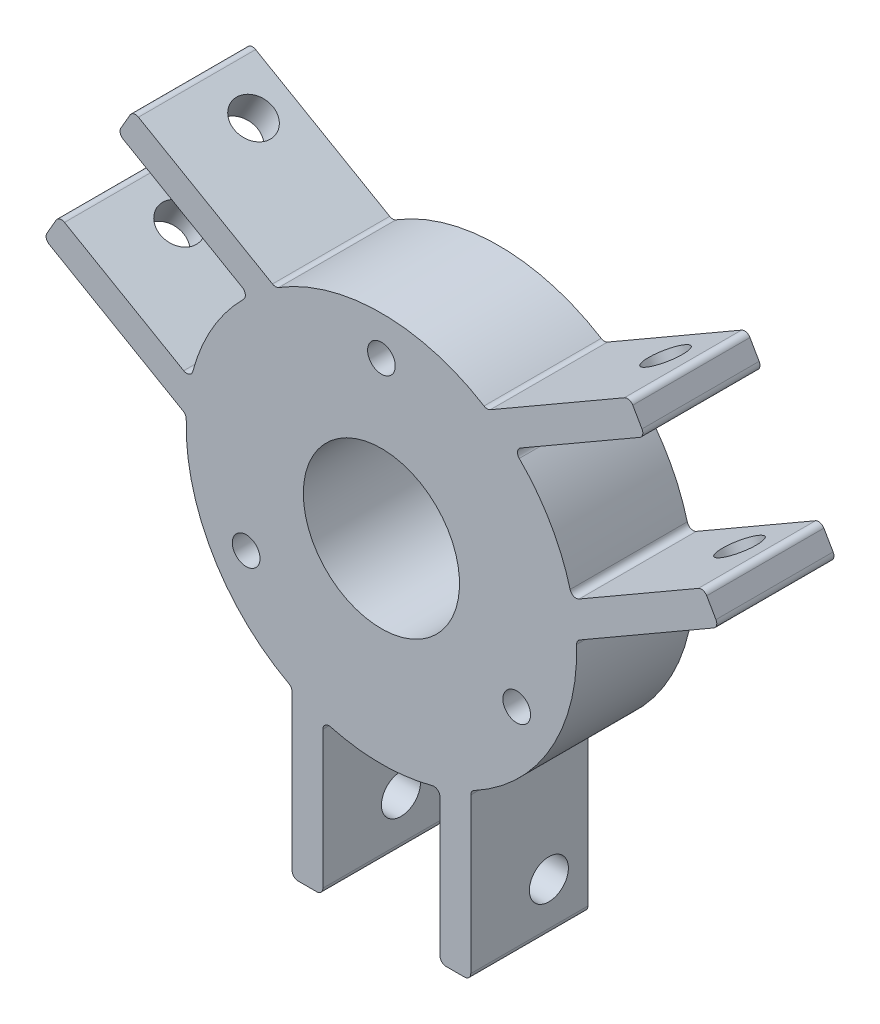
from build123d import *

# Parameters (mm, degrees)
ESQUISSE1_R             = 31.75
ESQUISSE1_R_2           = 12.7
ESQUISSE1_R_3           = 2.25
BOSS_EXTRU_1_DEPTH      = 19.05
BOSS_EXTRU_2_DEPTH      = 19.05
ESQUISSE3_R             = 3.175
ENL_V_MAT_EXTRU_1_DEPTH = 94.772298796
ESQUISSE4_R             = 3.175
ENL_V_MAT_EXTRU_2_DEPTH = 94.772298796
ESQUISSE5_R             = 3.175
ENL_V_MAT_EXTRU_3_DEPTH = 91.591863816
CONG_1_R                = 1


with BuildPart() as part:
    # Esquisse1 → Boss.-Extru.1 (new body)
    with BuildSketch(Plane.XY):
        with Locations(Location((0, 0, 0), (0, 0, 180))):
            Circle(ESQUISSE1_R)
        with Locations(Location((0, 0, 0), (0, 0, 180))):
            Circle(ESQUISSE1_R_2, mode=Mode.SUBTRACT)
        with Locations(Location((0, 25.4, 0), (0, 0, 180))):
            Circle(ESQUISSE1_R_3, mode=Mode.SUBTRACT)
        with Locations(Location((-21.997045256, -12.7, 0), (0, 0, 180))):
            Circle(ESQUISSE1_R_3, mode=Mode.SUBTRACT)
        with Locations(Location((21.997045256, -12.7, 0), (0, 0, 180))):
            Circle(ESQUISSE1_R_3, mode=Mode.SUBTRACT)
    extrude(amount=BOSS_EXTRU_1_DEPTH)

    # Esquisse2 → Boss.-Extru.2 (add)
    with BuildSketch(Plane.XY.offset(19.05)):
        Polygon((42.868897208, 35.748891971), (21.467304731, 23.392676794), (17.187758818, 26.6953825), (40.368897208, 40.07901899), align=None)
        Polygon((30.992304731, 6.894892851), (31.712758818, 1.53734452), (54.893897208, 14.92098101), (52.393897208, 19.251108029), align=None)
        Polygon((14.525, -55), (14.525, -28.23272702), (9.525, -30.287569645), (9.525, -55), align=None)
        Polygon((-9.525, -30.287569645), (-14.525, -28.23272702), (-14.525, -55), (-9.525, -55), align=None)
        Polygon((-54.893897208, 14.92098101), (-31.712758818, 1.53734452), (-30.992304731, 6.894892851), (-52.393897208, 19.251108029), align=None)
        Polygon((-21.467304731, 23.392676794), (-17.187758818, 26.6953825), (-40.368897208, 40.07901899), (-42.868897208, 35.748891971), align=None)
    extrude(amount=-BOSS_EXTRU_2_DEPTH)

    # Esquisse3 → Enlèv. mat.-Extru.1 (cut, through all)
    with BuildSketch(Plane(origin=(7.2625, 12.57901899, 0), x_dir=(0.8660254037845352, -0.49999999999983297, 0), z_dir=(0.4999999999998329, 0.8660254037845351, 0))):
        with Locations(Location((-47.0625, -6.35, 0), (0, 0, 180))):
            Circle(ESQUISSE3_R)
    extrude(amount=-ENL_V_MAT_EXTRU_1_DEPTH, mode=Mode.SUBTRACT)

    # Esquisse4 → Enlèv. mat.-Extru.2 (cut, through all)
    with BuildSketch(Plane(origin=(-7.2625, 12.57901899, 0), x_dir=(0.8660254037844395, 0.4999999999999985, 0), z_dir=(-0.4999999999999985, 0.8660254037844395, 0))):
        with Locations(Location((47.0625, -6.35, 0), (0, 0, 180))):
            Circle(ESQUISSE4_R)
    extrude(amount=-ENL_V_MAT_EXTRU_2_DEPTH, mode=Mode.SUBTRACT)

    # Esquisse5 → Enlèv. mat.-Extru.3 (cut, through all)
    with BuildSketch(Plane(origin=(14.525, 0, 0), x_dir=(0, 0, -1), z_dir=(1, 0, 0))):
        with Locations(Location((-6.35, -47.0625, 0), (0, 0, 90))):
            Circle(ESQUISSE5_R)
    extrude(amount=-ENL_V_MAT_EXTRU_3_DEPTH, mode=Mode.SUBTRACT)

    # Congé1
    cong_1_edges = [part.edges().sort_by_distance(p)[0] for p in [
        (40.368897208, 40.07901899, 9.525),
        (42.868897208, 35.748891971, 9.525),
        (21.467304731, 23.392676794, 9.525),
        (17.187758818, 26.6953825, 9.525),
        (30.992304731, 6.894892851, 9.525),
        (52.393897208, 19.251108029, 9.525),
        (54.893897208, 14.92098101, 9.525),
        (31.712758818, 1.53734452, 9.525),
        (14.525, -55, 9.525),
        (9.525, -55, 9.525),
        (9.525, -30.287569645, 9.525),
        (14.525, -28.23272702, 9.525),
        (-9.525, -30.287569645, 9.525),
        (-9.525, -55, 9.525),
        (-14.525, -55, 9.525),
        (-14.525, -28.23272702, 9.525),
        (-54.893897208, 14.92098101, 9.525),
        (-52.393897208, 19.251108029, 9.525),
        (-30.992304731, 6.894892851, 9.525),
        (-31.712758818, 1.53734452, 9.525),
        (-21.467304731, 23.392676794, 9.525),
        (-42.868897208, 35.748891971, 9.525),
        (-40.368897208, 40.07901899, 9.525),
        (-17.187758818, 26.6953825, 9.525),
    ]]
    fillet(cong_1_edges, radius=CONG_1_R)


solid = part.part
